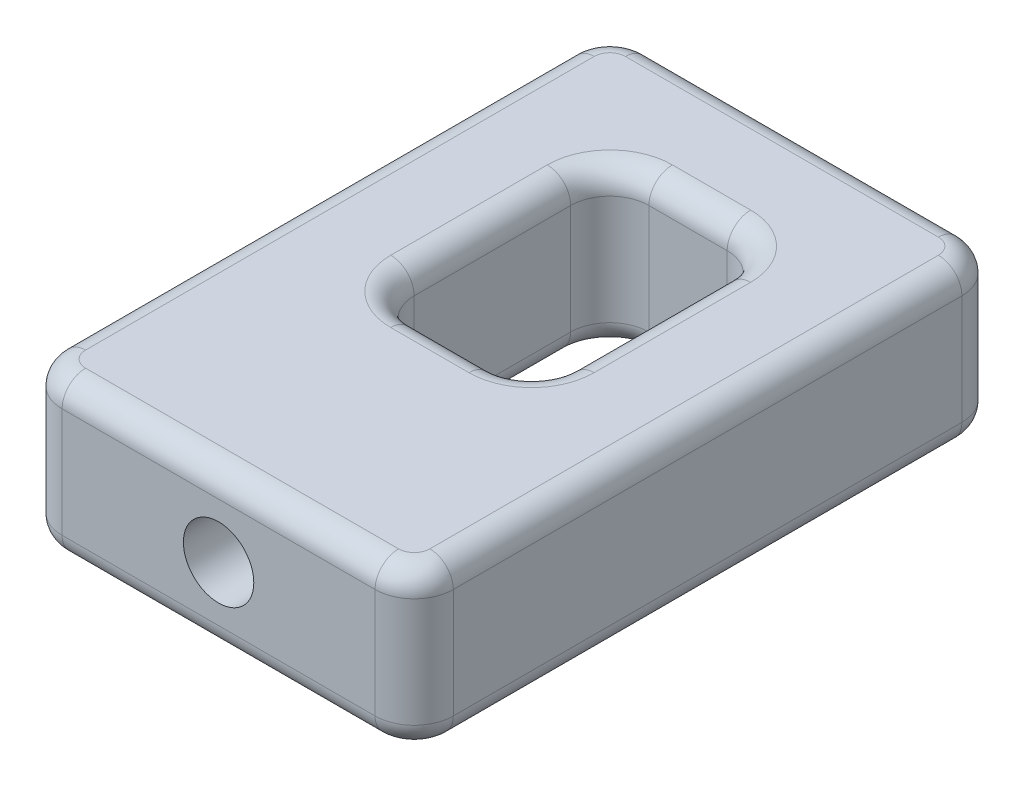
from build123d import *

# Parameters (mm, degrees)
SKETCH1_W           = 12.7
SKETCH1_H           = 19.05
BOSS_EXTRUDE1_DEPTH = 5.08
SKETCH2_W           = 5.08
SKETCH2_H           = 7.62
CUT_EXTRUDE1_DEPTH  = 13.524157656
SKETCH3_R           = 1.143
CUT_EXTRUDE3_DEPTH  = 8.382
FILLET1_R           = 1.27
FILLET2_R           = 1.27
FILLET3_R           = 0.762
FILLET4_R           = 0.762


with BuildPart() as part:
    # Sketch1 → Boss-Extrude1 (new body)
    with BuildSketch(Plane(origin=(0, 0, 0), x_dir=(1, 0, 0), z_dir=(0, 1, 0))):
        Rectangle(SKETCH1_W, SKETCH1_H)
    extrude(amount=BOSS_EXTRUDE1_DEPTH)

    # Sketch2 → Cut-Extrude1 (cut, through all)
    with BuildSketch(Plane.XZ):
        with Locations((0, -1.905)):
            Rectangle(SKETCH2_W, SKETCH2_H)
    extrude(amount=-CUT_EXTRUDE1_DEPTH, mode=Mode.SUBTRACT)

    # Sketch3 → Cut-Extrude3 (cut)
    with BuildSketch(Plane.XY.offset(9.525)):
        with Locations((0, 2.54)):
            Circle(SKETCH3_R)
    extrude(amount=-CUT_EXTRUDE3_DEPTH, mode=Mode.SUBTRACT)

    # Fillet1
    fillet1_edges = [part.edges().sort_by_distance(p)[0] for p in [
        (6.35, 2.54, 9.525),
        (-6.35, 2.54, 9.525),
        (-6.35, 2.54, -9.525),
        (6.35, 2.54, -9.525),
    ]]
    fillet(fillet1_edges, radius=FILLET1_R)

    # Fillet2
    fillet2_edges = [part.edges().sort_by_distance(p)[0] for p in [
        (2.54, 2.54, 1.905),
        (2.54, 2.54, -5.715),
        (-2.54, 2.54, -5.715),
        (-2.54, 2.54, 1.905),
    ]]
    fillet(fillet2_edges, radius=FILLET2_R)

    # Fillet3
    fillet3_edges = [part.edges().sort_by_distance(p)[0] for p in [
        (0, 5.08, -9.525),
        (6.35, 5.08, 0),
        (-6.35, 5.08, 0),
        (0, 5.08, 9.525),
        (5.978025612, 5.08, 9.153025612),
        (-5.978025612, 5.08, 9.153025612),
        (-5.978025612, 5.08, -9.153025612),
        (5.978025612, 5.08, -9.153025612),
    ]]
    fillet(fillet3_edges, radius=FILLET3_R)

    # Fillet4
    fillet4_edges = [part.edges().sort_by_distance(p)[0] for p in [
        (0, 0, -9.525),
        (6.35, 0, 0),
        (0, 0, 9.525),
        (-6.35, 0, 0),
        (5.978025612, 0, 9.153025612),
        (-5.978025612, 0, 9.153025612),
        (-5.978025612, 0, -9.153025612),
        (5.978025612, 0, -9.153025612),
        (0, 0, -5.715),
        (0, 5.08, -5.715),
        (-2.54, 0, -1.905),
        (-2.54, 5.08, -1.905),
        (2.54, 0, -1.905),
        (2.54, 5.08, -1.905),
        (0, 0, 1.905),
        (0, 5.08, 1.905),
        (-2.168025612, 0, -5.343025612),
        (-2.168025612, 5.08, -5.343025612),
        (2.168025612, 0, -5.343025612),
        (2.168025612, 5.08, -5.343025612),
        (-2.168025612, 0, 1.533025612),
        (-2.168025612, 5.08, 1.533025612),
        (2.168025612, 0, 1.533025612),
        (2.168025612, 5.08, 1.533025612),
    ]]
    fillet(fillet4_edges, radius=FILLET4_R)


solid = part.part
